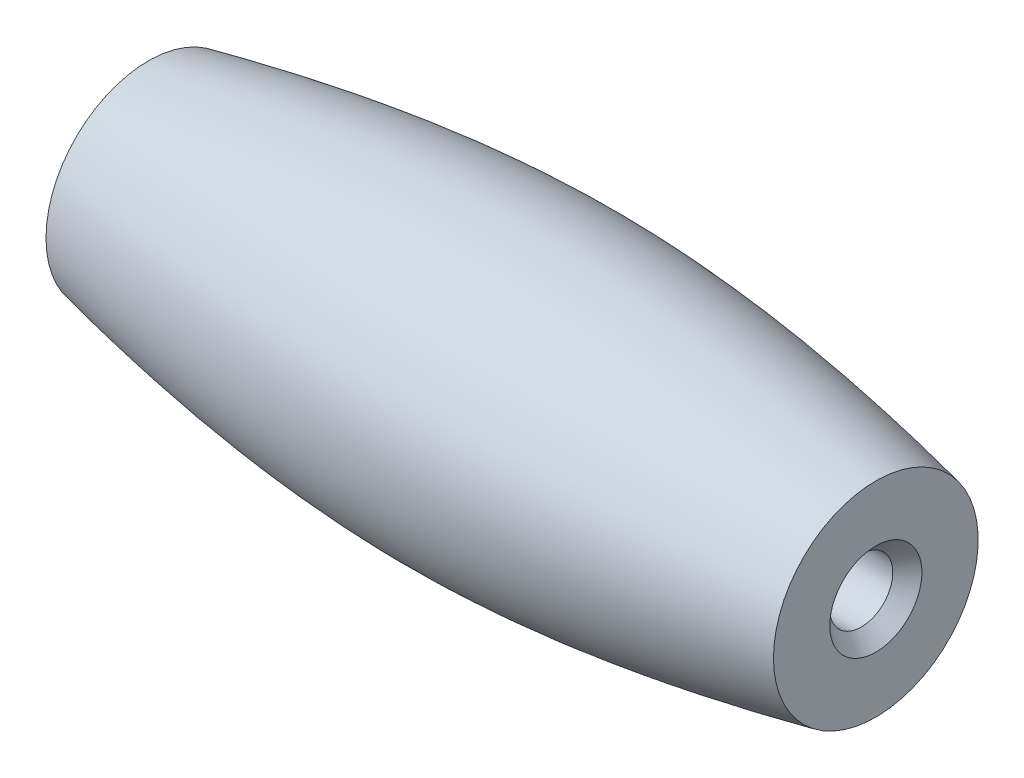
from build123d import *

# Parameters (mm, degrees)
SKETCH_2_R          = 1.3
CUT_EXTRUDE_1_DEPTH = 37.109501957
CHAMFER_1_SIZE      = 0.6


with BuildPart() as part:
    # 草图1 → 旋转1 (revolve)
    with BuildSketch(Plane(origin=(0, 0, 0), x_dir=(1, 0, 0), z_dir=(0, 1, 0))):
        with BuildLine():
            Line((4.202250373, -8.960092976), (4.202250373, -13.180607295))
            Line((4.202250373, -13.180607295), (34.202250373, -13.180607295))
            Line((34.202250373, -13.180607295), (34.202250373, -8.960092976))
            add(Edge.make_bspline(
                [(4.202250373, -8.960092976), (9.281734141, -7.880415372), (19.175765631, -6.475169713), (29.17573609, -7.891674383), (34.202250373, -8.960092976)],
                knots=[0, 0, 0, 0, 0.5, 1, 1, 1, 1], degree=3))
        make_face()
    revolve(axis=Axis((4.202250373, 0, 13.180607295), (1, 0, 0)))

    # 草图2 → 切除-拉伸1 (cut, through all)
    with BuildSketch(Plane(origin=(34.202250373, 0, 0), x_dir=(0, 0, -1), z_dir=(1, 0, 0))):
        with Locations((-13.180607295, 0)):
            Circle(SKETCH_2_R)
    extrude(amount=-CUT_EXTRUDE_1_DEPTH, mode=Mode.SUBTRACT)

    # 倒角1
    chamfer_1_edges = [part.edges().sort_by_distance(p)[0] for p in [
        (4.202250373, 0, 14.480607295),
        (34.202250373, 0, 14.480607295),
    ]]
    chamfer(chamfer_1_edges, length=CHAMFER_1_SIZE)


solid = part.part
